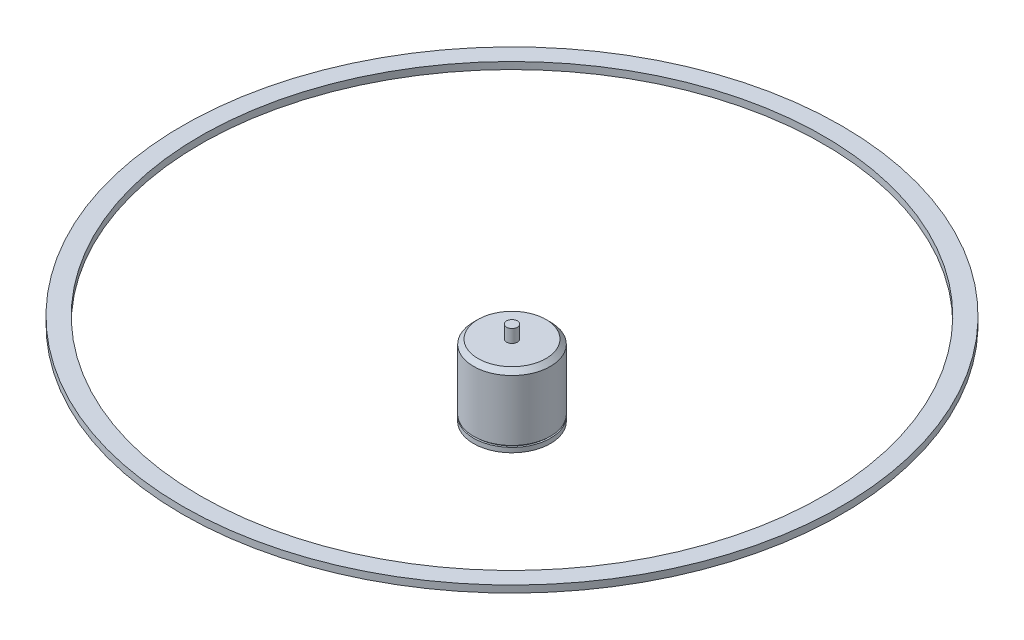
from build123d import *

# Parameters (mm, degrees)
SKETCH2_R           = 120.015
SKETCH2_R_2         = 113.503262111
BOSS_EXTRUDE1_DEPTH = 2.54


with BuildPart() as part:
    # Sketch1 → Revolve1 (revolve)
    with BuildSketch(Plane.XY):
        Polygon((0, 0), (14, 0), (14, 1.712753025), (13.377430193, 1.712753025), (13.377430193, 2.303284787), (14, 2.303284787), (14, 24.362224429), (12.362224429, 26), (1.99505291, 26), (1.99505291, 30.72050638), (0, 30.72050638), align=None)
    revolve(axis=Axis((0, 30.72050638, 0), (0, -1, 0)))


with BuildPart() as body_2:
    # Sketch2 → Boss-Extrude1 (new body)
    with BuildSketch(Plane(origin=(0, 30.72050638, 0), x_dir=(1, 0, 0), z_dir=(0, 1, 0))):
        Circle(SKETCH2_R)
        Circle(SKETCH2_R_2, mode=Mode.SUBTRACT)
    extrude(amount=BOSS_EXTRUDE1_DEPTH)


solid = Compound([part.part, body_2.part])
